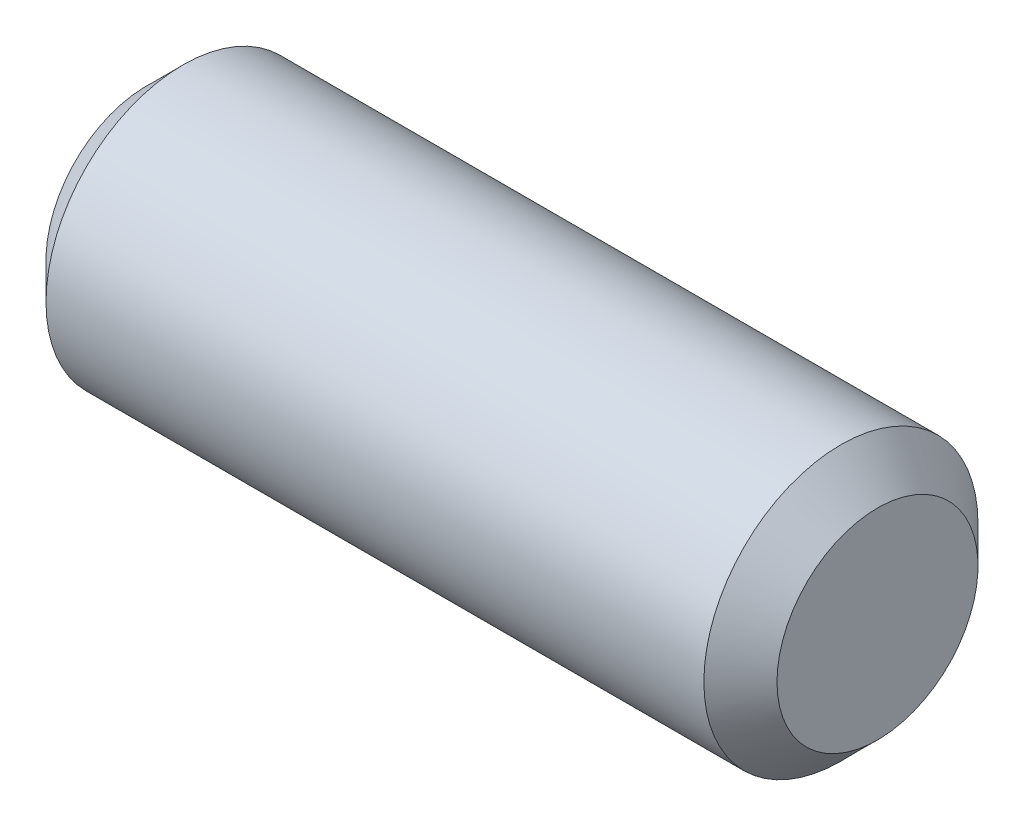
from build123d import *

# Parameters (mm, degrees)
SKETCH_1_W     = 16
SKETCH_1_H     = 3
CHAMFER_1_SIZE = 0.8


with BuildPart() as part:
    # 草图1 → 旋转1 (revolve)
    with BuildSketch(Plane.XY, mode=Mode.PRIVATE) as revolve_1_sk:
        with Locations((2.657303371, 1.5)):
            Rectangle(SKETCH_1_W, SKETCH_1_H)
    revolve(revolve_1_sk.sketch.rotate(Axis((-6.320224719, 0, 0), (1, 0, 0)), 90), axis=Axis((-6.320224719, 0, 0), (1, 0, 0)))

    # 倒角1
    chamfer_1_edges = [part.edges().sort_by_distance(p)[0] for p in [
        (10.657303371, 0, -3),
        (-5.342696629, 0, -3),
    ]]
    chamfer(chamfer_1_edges, length=CHAMFER_1_SIZE)


solid = part.part
